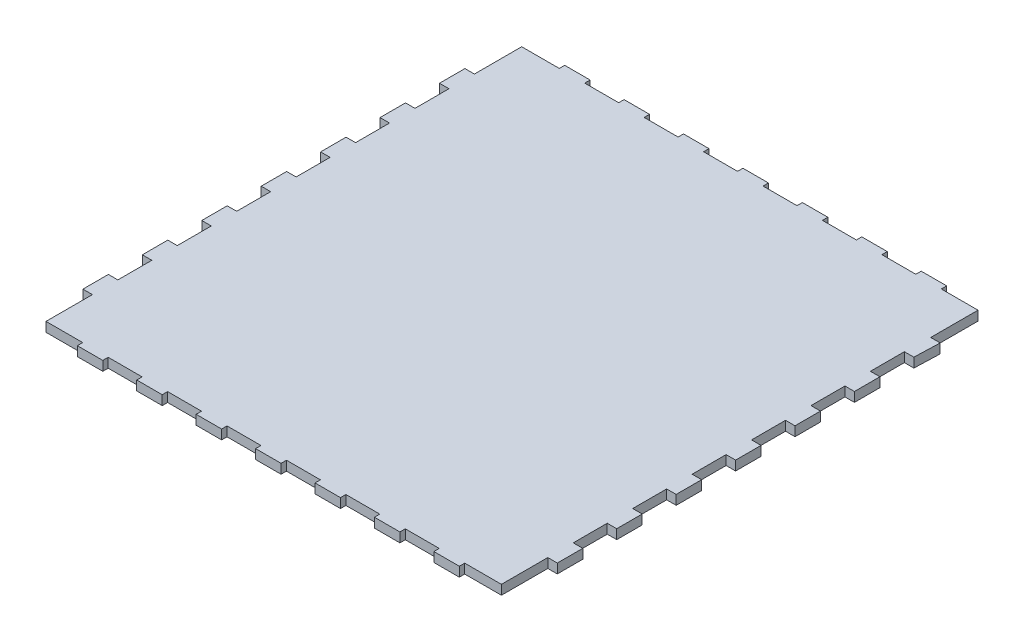
from build123d import *

# Parameters (mm, degrees)
BOSS_EXTRUDE1_DEPTH = 5.588


with BuildPart() as part:
    # Sketch1 → Boss-Extrude1 (new body)
    with BuildSketch(Plane(origin=(0, 0, 0), x_dir=(1, 0, 0), z_dir=(0, 1, 0))):
        Polygon((126.341039054, -164.993943005), (141.341024892, -164.993943005), (141.341024892, -161.818943005), (162.95709589, -161.818943005), (162.95709589, -134.500016194), (168.54509589, -134.500016194), (168.54509589, -119.500016194), (162.95709589, -119.500016194), (162.95709589, -99.500016194), (168.54509589, -99.500016194), (168.54509589, -84.500016194), (162.95709589, -84.500016194), (162.95709589, -64.500016194), (168.54509589, -64.500016194), (168.54509589, -49.500016194), (162.95709589, -49.500016194), (162.95709589, -29.500016194), (168.54509589, -29.500016194), (168.54509589, -14.500016194), (162.95709589, -14.500016194), (162.95709589, 5.499983806), (168.54509589, 5.499983806), (168.54509589, 20.499983806), (162.95709589, 20.499983806), (162.95709589, 40.499983806), (168.54509589, 40.499983806), (168.54509589, 55.499983806), (162.95709589, 55.499983806), (162.95709589, 75.499983806), (168.54509589, 75.499983806), (169.05309589, 90.499983806), (163.46509589, 90.499983806), (163.46509589, 118.350250113), (141.85309589, 118.350250113), (141.85309589, 121.525250113), (126.85309589, 121.525250113), (126.85309589, 118.350250113), (106.85309589, 118.350250113), (106.85309589, 121.525250113), (91.85309589, 121.525250113), (91.85309589, 118.350250113), (71.85309589, 118.350250113), (71.85309589, 121.525250113), (56.85309589, 121.525250113), (56.85309589, 118.350250113), (36.85309589, 118.350250113), (36.85309589, 121.525250113), (21.85309589, 121.525250113), (21.85309589, 118.350250113), (1.85309589, 118.350250113), (1.85309589, 121.525250113), (-13.14690411, 121.525250113), (-13.14690411, 118.350250113), (-33.14690411, 118.350250113), (-33.14690411, 121.525250113), (-48.14690411, 121.525250113), (-48.14690411, 118.350250113), (-68.14690411, 118.350250113), (-68.14690411, 121.525250113), (-83.14690411, 121.525250113), (-83.14690411, 118.350250113), (-105.26690411, 118.350250113), (-105.26690411, 90.499983806), (-110.85490411, 90.499983806), (-110.85490411, 75.499983806), (-105.26690411, 75.499983806), (-105.26690411, 55.499983806), (-110.85490411, 55.499983806), (-110.85490411, 40.499983806), (-105.26690411, 40.499983806), (-105.26690411, 20.499983806), (-110.85490411, 20.499983806), (-110.85490411, 5.499983806), (-105.26690411, 5.499983806), (-105.26690411, -14.500016194), (-110.85490411, -14.500016194), (-110.85490411, -29.500016194), (-105.26690411, -29.500016194), (-105.26690411, -49.500016194), (-110.85490411, -49.500016194), (-110.85490411, -64.500016194), (-105.26690411, -64.500016194), (-105.26690411, -84.500016194), (-110.85490411, -84.500016194), (-110.85490411, -99.500016194), (-105.26690411, -99.500016194), (-105.26690411, -119.500016194), (-110.85490411, -119.500016194), (-110.85490411, -134.500016194), (-105.26690411, -134.500016194), (-105.26690411, -161.818943005), (-83.65490411, -161.818943005), (-83.65490411, -164.993943005), (-68.65490411, -164.993943005), (-68.65490411, -161.818943005), (-48.650866156, -161.818943005), (-48.650866156, -164.993943005), (-33.65490411, -164.993943005), (-33.65490411, -161.818943005), (-13.65490411, -161.818943005), (-13.65490411, -164.993943005), (1.349086638, -164.993943005), (1.349086638, -161.818943005), (21.34509589, -161.818943005), (21.34509589, -164.993943005), (36.341124024, -164.993943005), (36.341124024, -161.818943005), (56.341105142, -161.818943005), (56.341105142, -164.993943005), (71.34109098, -164.993943005), (71.34109098, -161.818943005), (91.34509589, -161.818943005), (91.34509589, -164.993943005), (106.34509589, -164.993943005), (106.34509589, -161.818943005), (126.341039054, -161.818943005), align=None)
    extrude(amount=BOSS_EXTRUDE1_DEPTH)


solid = part.part
